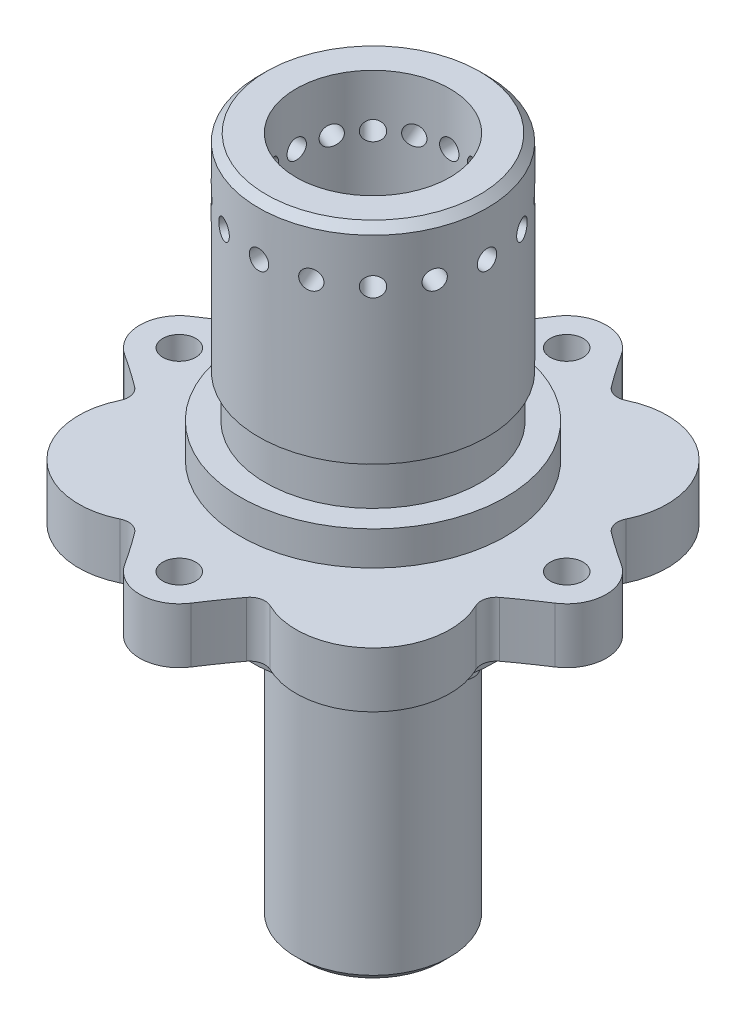
from build123d import *

# Parameters (mm, degrees)
SKETCH5_W                     = 15.875
SKETCH5_H                     = 79.375
DRIVE_PIN_HOLES_D             = 6.8
DRIVE_PIN_HOLES_PATTERN_COUNT = 4
FLANGE_SUPPORT_CUT_REACH      = 104.834
SKETCH8_R                     = 52.5
SKETCH10_R                    = 25.0825
BRAKE_HAT_HEX_DEPTH           = 4.7625
F_5_16_CLEARANCE_HOLE1_D      = 8.2042
SKETCH14_R                    = 2
PIN_HOLES_DEPTH               = 99.496921864
PIN_HOLE_PATTERN_COUNT        = 16
FILLET1_R                     = 3.175
FILLET2_R                     = 3.175


with BuildPart() as part:
    # Sketch1 → Bearing Shaft/Flange Support (revolve)
    with BuildSketch(Plane(origin=(0, 0, 0), x_dir=(0, 0, -1), z_dir=(1, 0, 0)), mode=Mode.PRIVATE) as bearing_shaft_flange_support_sk:
        Polygon((0, 0), (-27.254672075, 0), (-25.0825, -12.319), (-25.0825, -17.0815), (-15.875, -17.0815), (-15.875, -69.56298), (-14.2875, -71.15048), (0, -71.15048), align=None)
    revolve(bearing_shaft_flange_support_sk.sketch.rotate(Axis((0, 0, 0), (0, 1, 0)), 180), axis=Axis((0, 0, 0), (0, 1, 0)))

    # Sketch2 → Drive Pin Support (revolve)
    with BuildSketch(Plane(origin=(0, 0, 0), x_dir=(0, 0, -1), z_dir=(1, 0, 0)), mode=Mode.PRIVATE) as drive_pin_support_sk:
        Polygon((0, 0), (-52.5, 0), (-52.5, 11.43), (-27.4096, 11.43), (-27.4096, 18.43), (-22.225, 18.43), (-22.225, 27.305), (-23.61946, 27.305), (-23.61946, 68.2625), (-22.03196, 69.85), (0, 69.85), align=None)
    revolve(drive_pin_support_sk.sketch.rotate(Axis((0, 0, 0), (0, 1, 0)), 180), axis=Axis((0, 0, 0), (0, 1, 0)))

    # Sketch5 → Center Mass Removal (revolve, cut)
    with BuildSketch(Plane(origin=(0, 0, 0), x_dir=(0, 0, -1), z_dir=(1, 0, 0)), mode=Mode.PRIVATE) as center_mass_removal_sk:
        with Locations((7.9375, 30.1625)):
            Rectangle(SKETCH5_W, SKETCH5_H)
    revolve(center_mass_removal_sk.sketch.rotate(Axis((0, 0, 0), (0, -1, 0)), 180), axis=Axis((0, 0, 0), (0, -1, 0)), mode=Mode.SUBTRACT)

    # Drive Pin Holes (through all)
    with Locations(Plane(origin=(0, 0, 0), x_dir=(-1, 0, 0), z_dir=(0, -1, 0))):
        with Locations((0, -40)):
            drive_pin_holes = Hole(DRIVE_PIN_HOLES_D / 2)

    # Drive Pin Holes Pattern: Drive Pin Holes ×4 about axis
    drive_pin_holes_pattern_axis = Axis((0, 0, 0), (0, 1, 0))
    for i in range(1, DRIVE_PIN_HOLES_PATTERN_COUNT):
        add(drive_pin_holes.rotate(drive_pin_holes_pattern_axis, i * 360 / DRIVE_PIN_HOLES_PATTERN_COUNT), mode=Mode.SUBTRACT)

    # Sketch8 → Flange Support Cut (cut, up to next)
    with BuildSketch(Plane.XZ, mode=Mode.PRIVATE) as flange_support_cut_sk1:
        Circle(SKETCH8_R)
        with BuildLine():
            ThreePointArc((6.851776468, 44.436165629), (0, 48.1625), (-6.851776468, 44.436165629))
            ThreePointArc((-6.851776468, 44.436165629), (-9.964767607, 39.850591878), (-13.274865482, 35.405206349))
            ThreePointArc((-13.274865482, 35.405206349), (-33.675960454, 33.675960454), (-35.405206349, 13.274865482))
            ThreePointArc((-35.405206349, 13.274865482), (-39.850591878, 9.964767607), (-44.436165629, 6.851776468))
            ThreePointArc((-44.436165629, 6.851776468), (-48.1625, 0), (-44.436165629, -6.851776468))
            ThreePointArc((-44.436165629, -6.851776468), (-39.850591878, -9.964767607), (-35.405206349, -13.274865482))
            ThreePointArc((-35.405206349, -13.274865482), (-33.675960454, -33.675960454), (-13.274865482, -35.405206349))
            ThreePointArc((-13.274865482, -35.405206349), (-9.964767607, -39.850591878), (-6.851776468, -44.436165629))
            ThreePointArc((-6.851776468, -44.436165629), (0, -48.1625), (6.851776468, -44.436165629))
            ThreePointArc((6.851776468, -44.436165629), (9.964767607, -39.850591878), (13.274865482, -35.405206349))
            ThreePointArc((13.274865482, -35.405206349), (33.675960454, -33.675960454), (35.405206349, -13.274865482))
            ThreePointArc((35.405206349, -13.274865482), (39.850591878, -9.964767607), (44.436165629, -6.851776468))
            ThreePointArc((44.436165629, -6.851776468), (48.1625, 0), (44.436165629, 6.851776468))
            ThreePointArc((44.436165629, 6.851776468), (39.850591878, 9.964767607), (35.405206349, 13.274865482))
            ThreePointArc((35.405206349, 13.274865482), (33.675960454, 33.675960454), (13.274865482, 35.405206349))
            ThreePointArc((13.274865482, 35.405206349), (9.964767607, 39.850591878), (6.851776468, 44.436165629))
        make_face(mode=Mode.SUBTRACT)
    flange_support_cut_tool1 = extrude(flange_support_cut_sk1.sketch, amount=-FLANGE_SUPPORT_CUT_REACH, mode=Mode.PRIVATE) & part.part
    add(flange_support_cut_tool1.solids().sort_by_distance((-51.015076, 0, 0))[0], mode=Mode.SUBTRACT)

    # Sketch10 → Brake Hat Hex (cut)
    with BuildSketch(Plane.XZ.offset(17.0815)):
        Circle(SKETCH10_R)
        Polygon((10.631905207, -18.415), (21.263810414, 0), (10.631905207, 18.415), (-10.631905207, 18.415), (-21.263810414, 0), (-10.631905207, -18.415), align=None, mode=Mode.SUBTRACT)
    extrude(amount=-BRAKE_HAT_HEX_DEPTH, mode=Mode.SUBTRACT)

    # 5/16 Clearance Hole1 (through all)
    with Locations(Plane(origin=(0, -71.15048, 0), x_dir=(-1, 0, 0), z_dir=(0, -1, 0))):
        with Locations((0, 0)):
            Hole(F_5_16_CLEARANCE_HOLE1_D / 2)

    # Sketch14 → Pin Holes (cut, through all)
    with BuildSketch(Plane(origin=(0, 0, 0), x_dir=(0, 0, -1), z_dir=(1, 0, 0))):
        with Locations((0, 59.05)):
            Circle(SKETCH14_R)
    pin_holes = extrude(amount=-PIN_HOLES_DEPTH, mode=Mode.SUBTRACT)

    # Pin Hole Pattern: Pin Holes ×16 about axis
    pin_hole_pattern_axis = Axis((0, 0, 0), (0, -1, 0))
    for i in range(1, PIN_HOLE_PATTERN_COUNT):
        add(pin_holes.rotate(pin_hole_pattern_axis, i * 360 / PIN_HOLE_PATTERN_COUNT), mode=Mode.SUBTRACT)

    # Fillet1
    fillet1_edges = [part.edges().sort_by_distance(p)[0] for p in [
        (-35.405206349, 5.715, -13.274865482),
        (-13.274865482, 5.715, -35.405206349),
        (13.274865482, 5.715, -35.405206349),
        (35.405206349, 5.715, -13.274865482),
        (35.405206349, 5.715, 13.274865482),
        (13.274865482, 5.715, 35.405206349),
        (-13.274865482, 5.715, 35.405206349),
        (-35.405206349, 5.715, 13.274865482),
    ]]
    fillet(fillet1_edges, radius=FILLET1_R)

    # Fillet2
    fillet2_edges = [part.edges().sort_by_distance(p)[0] for p in [
        (-10.631905207, -14.70025, -18.415),
        (-21.263810414, -14.70025, 0),
        (-10.631905207, -14.70025, 18.415),
        (10.631905207, -14.70025, 18.415),
        (21.263810414, -14.70025, 0),
        (10.631905207, -14.70025, -18.415),
    ]]
    fillet(fillet2_edges, radius=FILLET2_R)


solid = part.part
